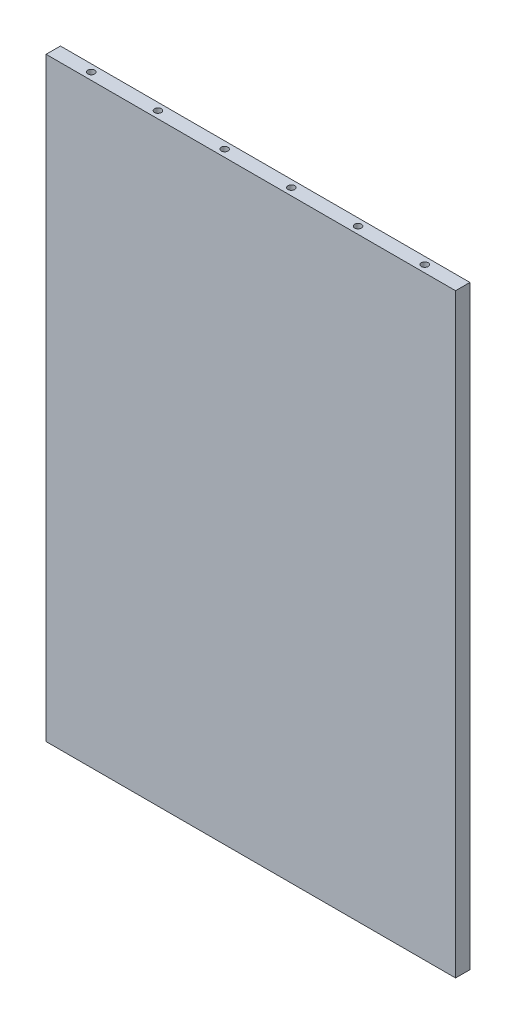
from build123d import *

# Parameters (mm, degrees)
SKETCH1_W                = 485
SKETCH1_H                = 705
BOSS_EXTRUDE1_DEPTH      = 17
CUT_EXTRUDE2_DEPTH       = 25
CUT_EXTRUDE2_DEPTH_BACK  = 13
SKETCH3_R                = 4
SKETCH8_R                = 2.5
CUT_EXTRUDE7_DEPTH       = 12
SKETCH9_R                = 2.5
CUT_EXTRUDE8_DEPTH       = 12
CUT_EXTRUDE20_DEPTH      = 25
CUT_EXTRUDE20_DEPTH_BACK = 13
SKETCH21_R               = 4
SKETCH22_R               = 2.5
CUT_EXTRUDE21_DEPTH      = 12
CUT_EXTRUDE22_DEPTH      = 25
CUT_EXTRUDE22_DEPTH_BACK = 13
SKETCH23_R               = 4
SKETCH25_R               = 2.5
CUT_EXTRUDE24_DEPTH      = 12


with BuildPart() as part:
    # Sketch1 → Boss-Extrude1 (new body)
    with BuildSketch(Plane.XY):
        with Locations((12.5, -380.5)):
            Rectangle(SKETCH1_W, SKETCH1_H)
    extrude(amount=-BOSS_EXTRUDE1_DEPTH)

    # Sketch3 → Cut-Extrude2 (cut, two sides: drawn at the far end of the back side and taken through both)
    with BuildSketch(Plane(origin=(0, -28, -249), x_dir=(0, 0, 1), z_dir=(0, -1, 0)).offset(-CUT_EXTRUDE2_DEPTH_BACK)):
        with Locations(Location((240.5, -210, 0), (0, 0, 90))):
            Circle(SKETCH3_R)
        with Locations(Location((240.5, -131, 0), (0, 0, 90))):
            Circle(SKETCH3_R)
        with Locations(Location((240.5, -52, 0), (0, 0, 90))):
            Circle(SKETCH3_R)
        with Locations(Location((240.5, 27, 0), (0, 0, 90))):
            Circle(SKETCH3_R)
        with Locations(Location((240.5, 106, 0), (0, 0, 90))):
            Circle(SKETCH3_R)
        with Locations(Location((240.5, 185, 0), (0, 0, 90))):
            Circle(SKETCH3_R)
    extrude(amount=CUT_EXTRUDE2_DEPTH + CUT_EXTRUDE2_DEPTH_BACK, mode=Mode.SUBTRACT)

    # Sketch8 → Cut-Extrude7 (cut)
    with BuildSketch(Plane(origin=(0, 0, -17), x_dir=(-1, 0, 0), z_dir=(0, 0, -1))):
        with Locations((193, -441.5)):
            Circle(SKETCH8_R)
        with Locations((-127, -441.5)):
            Circle(SKETCH8_R)
    extrude(amount=-CUT_EXTRUDE7_DEPTH, mode=Mode.SUBTRACT)

    # Sketch9 → Cut-Extrude8 (cut)
    with BuildSketch(Plane(origin=(0, 0, -17), x_dir=(-1, 0, 0), z_dir=(0, 0, -1))):
        with Locations((193, -262)):
            Circle(SKETCH9_R)
        with Locations((-127, -262)):
            Circle(SKETCH9_R)
    extrude(amount=-CUT_EXTRUDE8_DEPTH, mode=Mode.SUBTRACT)

    # Sketch21 → Cut-Extrude20 (cut, two sides: drawn at the far end of the back side and taken through both)
    with BuildSketch(Plane(origin=(0, 0, -17), x_dir=(-1, 0, 0), z_dir=(0, 0, -1)).offset(-CUT_EXTRUDE20_DEPTH_BACK)):
        with Locations((-245.5, -83)):
            Circle(SKETCH21_R)
        with Locations((-245.5, -200)):
            Circle(SKETCH21_R)
        with Locations((-245.5, -317)):
            Circle(SKETCH21_R)
        with Locations((-245.5, -434)):
            Circle(SKETCH21_R)
        with Locations((-245.5, -551)):
            Circle(SKETCH21_R)
        with Locations((-245.5, -668)):
            Circle(SKETCH21_R)
    extrude(amount=CUT_EXTRUDE20_DEPTH + CUT_EXTRUDE20_DEPTH_BACK, mode=Mode.SUBTRACT)

    # Sketch22 → Cut-Extrude21 (cut)
    with BuildSketch(Plane(origin=(0, 0, -17), x_dir=(-1, 0, 0), z_dir=(0, 0, -1))):
        with Locations((193, -610)):
            Circle(SKETCH22_R)
        with Locations((-127, -610)):
            Circle(SKETCH22_R)
    extrude(amount=-CUT_EXTRUDE21_DEPTH, mode=Mode.SUBTRACT)

    # Sketch23 → Cut-Extrude22 (cut, two sides: drawn at the far end of the back side and taken through both)
    with BuildSketch(Plane(origin=(0, -733, -249), x_dir=(0, 0, 1), z_dir=(0, 1, 0)).offset(-CUT_EXTRUDE22_DEPTH_BACK)):
        with Locations(Location((240.5, 210, 0), (0, 0, 270))):
            Circle(SKETCH23_R)
        with Locations(Location((240.5, 131, 0), (0, 0, 270))):
            Circle(SKETCH23_R)
        with Locations(Location((240.5, 52, 0), (0, 0, 270))):
            Circle(SKETCH23_R)
        with Locations(Location((240.5, -27, 0), (0, 0, 270))):
            Circle(SKETCH23_R)
        with Locations(Location((240.5, -106, 0), (0, 0, 270))):
            Circle(SKETCH23_R)
        with Locations(Location((240.5, -185, 0), (0, 0, 270))):
            Circle(SKETCH23_R)
    extrude(amount=CUT_EXTRUDE22_DEPTH + CUT_EXTRUDE22_DEPTH_BACK, mode=Mode.SUBTRACT)

    # Sketch25 → Cut-Extrude24 (cut)
    with BuildSketch(Plane(origin=(0, 0, -17), x_dir=(-1, 0, 0), z_dir=(0, 0, -1))):
        with Locations((193, -92.5)):
            Circle(SKETCH25_R)
        with Locations((-127, -92.5)):
            Circle(SKETCH25_R)
    extrude(amount=-CUT_EXTRUDE24_DEPTH, mode=Mode.SUBTRACT)


solid = part.part
